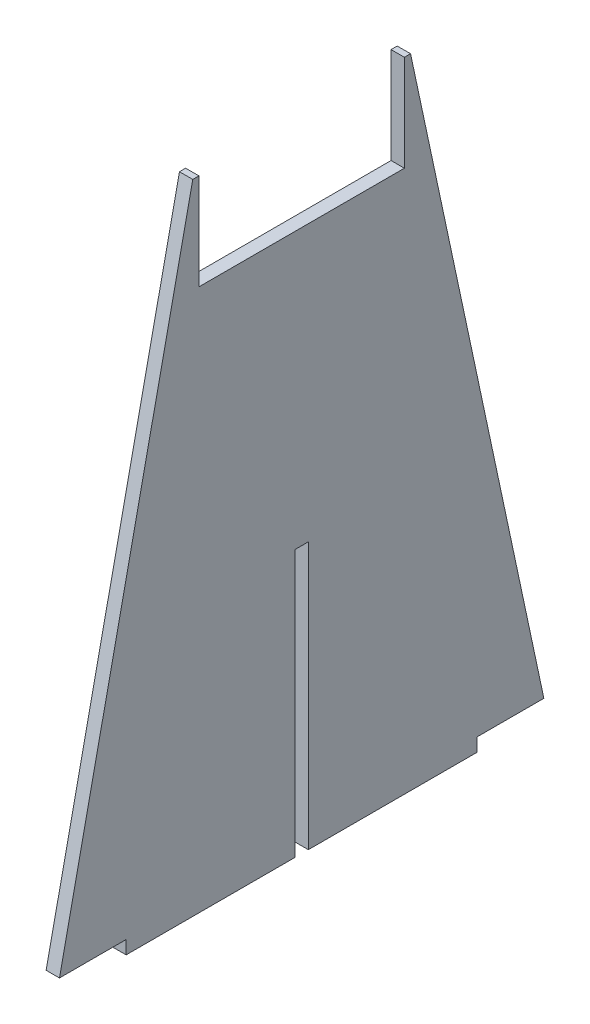
from build123d import *

# Parameters (mm, degrees)
EXTRUDE_1_DEPTH     = 3
BOSS_EXTRUDE1_DEPTH = 3


with BuildPart() as part:
    # Эскиз1 → Бобышка-Вытянуть1 (new body)
    with BuildSketch(Plane(origin=(0, 0, 0), x_dir=(0, 0, -1), z_dir=(1, 0, 0))):
        Polygon((54.5, 0), (29.113333333, 119), (-29.113333333, 119), (-54.5, 0), (-39.5, 0), (-39.5, -3), (-1.5, -3), (-1.5, 57), (1.5, 57), (1.5, -3), (39.5, -3), (39.5, 0), align=None)
    extrude(amount=EXTRUDE_1_DEPTH)

    # Sketch1 → Boss-Extrude1 (add)
    with BuildSketch(Plane(origin=(3, 0, 0), x_dir=(0, 0, -1), z_dir=(1, 0, 0))):
        Polygon((-29.113333333, 119), (-24.5, 140.625), (-23.113333333, 140.625), (-23.113333333, 119), align=None)
        Polygon((29.113333333, 119), (24.5, 140.625), (23.113333333, 140.625), (23.113333333, 119), align=None)
    extrude(amount=-BOSS_EXTRUDE1_DEPTH)


solid = part.part
